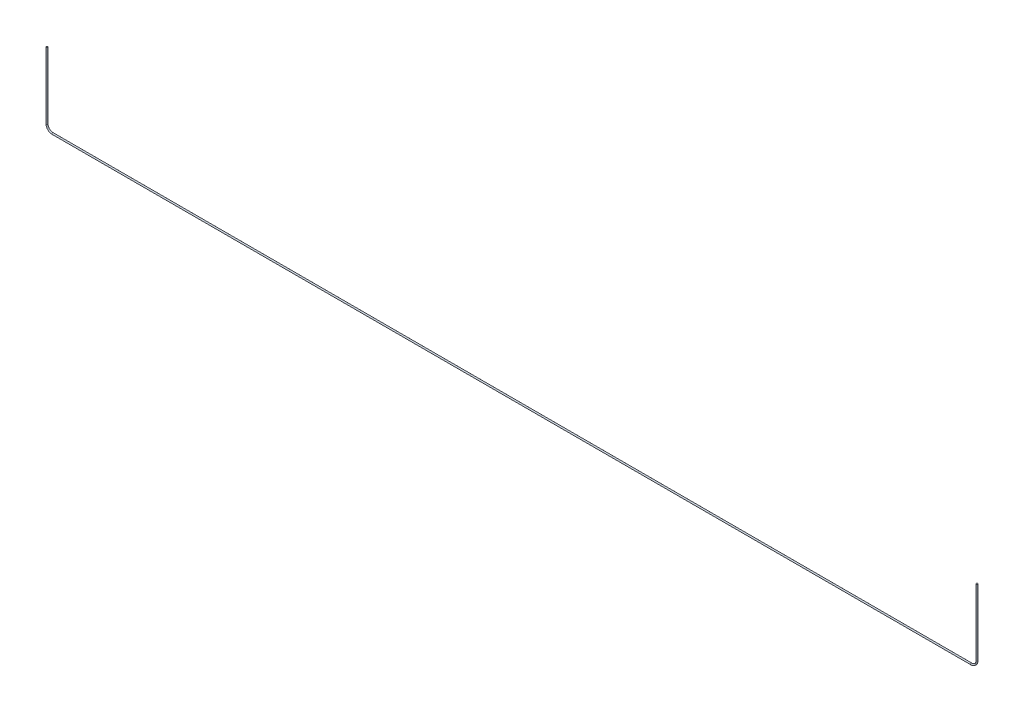
from build123d import *

# Parameters (mm, degrees)
SWEEP2_PROFILE_R = 6.35


with BuildPart() as part:
    # Sweep2: sweep along a path in Sketch6
    with BuildLine(Plane.XY) as sweep2_path:
        Line((-4120, 640), (-4120, 50))
        ThreePointArc((-4120, 50), (-4105.355339059, 14.644660941), (-4070, 0))
        Line((-4070, 0), (4070, 0))
        ThreePointArc((4070, 0), (4105.355339059, 14.644660941), (4120, 50))
        Line((4120, 50), (4120, 640))
    # Sweep2 profile (on start of the path) → Sweep2 (sweep)
    with BuildSketch(Plane(origin=(-4120, 640, 0), x_dir=(0, 0, -1), z_dir=(0, -1, 0))):
        Circle(SWEEP2_PROFILE_R)
    sweep(path=sweep2_path.line)


solid = part.part
